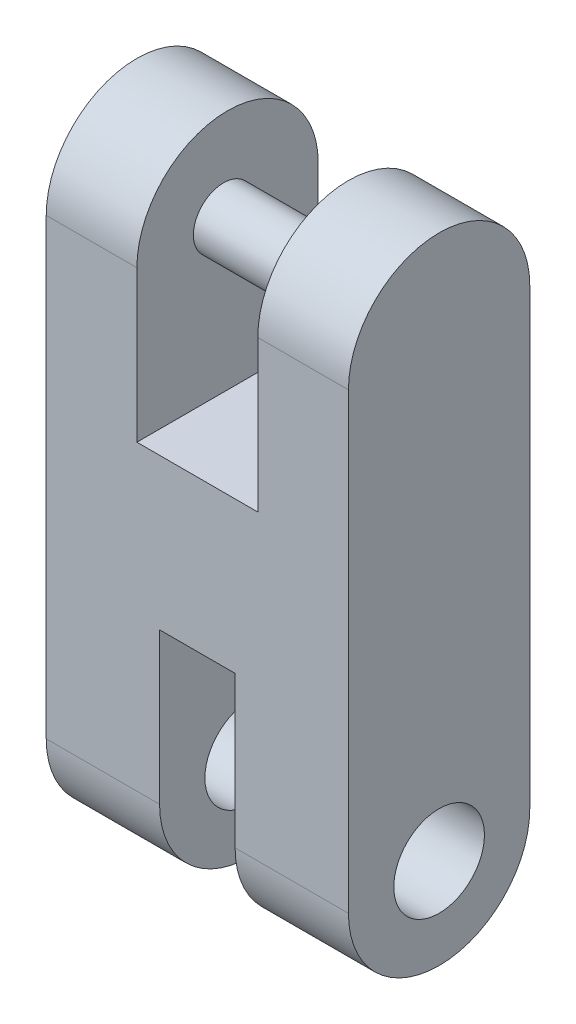
from build123d import *

# Parameters (mm, degrees)
SALIENTE_EXTRUIR1_DEPTH = 6
REDONDEO1_RADIUS        = 3
REDONDEO1_LENGTH        = 3.75
REDONDEO2_RADIUS        = 3
REDONDEO2_LENGTH        = 3
REDONDEO3_RADIUS        = 3
REDONDEO3_LENGTH        = 3
REDONDEO4_RADIUS        = 3
REDONDEO4_LENGTH        = 3.75
CORTAR_EXTRUIR1_REACH   = 26.021
CROQUIS2_R              = 1.5
SALIENTE_EXTRUIR3_REACH = 24.935
CROQUIS4_R              = 1


with BuildPart() as part:
    # Croquis1 → Saliente-Extruir1 (new body)
    with BuildSketch(Plane.XY):
        Polygon((-7, 21), (-7, 13), (-3, 13), (-3, 21), (0, 21), (0, 0), (-3.75, 0), (-3.75, 8), (-6.25, 8), (-6.25, 0), (-10, 0), (-10, 21), align=None)
    extrude(amount=SALIENTE_EXTRUIR1_DEPTH)

    # Redondeo1: full round fillet: the end face becomes a half cylinder, R = half its width
    redondeo1_face = Plane((-1.875, 0, 3), x_dir=(1, 0, 0), z_dir=(0, -1, 0))  # on the end face: x along it, z out of the body
    redondeo1_slab = redondeo1_face.offset(-REDONDEO1_RADIUS / 2) * Box(REDONDEO1_LENGTH, 2 * REDONDEO1_RADIUS, REDONDEO1_RADIUS, mode=Mode.PRIVATE)  # the body's end, R deep
    redondeo1_round = Plane((-1.875, 3, 3), x_dir=(0, -1, 0), z_dir=(1, 0, 0)) * Cylinder(REDONDEO1_RADIUS, REDONDEO1_LENGTH, mode=Mode.PRIVATE)  # its axis R under the face
    add(redondeo1_slab - redondeo1_round, mode=Mode.SUBTRACT)

    # Redondeo2: full round fillet: the end face becomes a half cylinder, R = half its width
    redondeo2_face = Plane((-1.5, 21, 3), x_dir=(-1, 0, 0), z_dir=(0, 1, 0))  # on the end face: x along it, z out of the body
    redondeo2_slab = redondeo2_face.offset(-REDONDEO2_RADIUS / 2) * Box(REDONDEO2_LENGTH, 2 * REDONDEO2_RADIUS, REDONDEO2_RADIUS, mode=Mode.PRIVATE)  # the body's end, R deep
    redondeo2_round = Plane((-1.5, 18, 3), x_dir=(0, 1, 0), z_dir=(-1, 0, 0)) * Cylinder(REDONDEO2_RADIUS, REDONDEO2_LENGTH, mode=Mode.PRIVATE)  # its axis R under the face
    add(redondeo2_slab - redondeo2_round, mode=Mode.SUBTRACT)

    # Redondeo3: full round fillet: the end face becomes a half cylinder, R = half its width
    redondeo3_face = Plane((-8.5, 21, 3), x_dir=(-1, 0, 0), z_dir=(0, 1, 0))  # on the end face: x along it, z out of the body
    redondeo3_slab = redondeo3_face.offset(-REDONDEO3_RADIUS / 2) * Box(REDONDEO3_LENGTH, 2 * REDONDEO3_RADIUS, REDONDEO3_RADIUS, mode=Mode.PRIVATE)  # the body's end, R deep
    redondeo3_round = Plane((-8.5, 18, 3), x_dir=(0, 1, 0), z_dir=(-1, 0, 0)) * Cylinder(REDONDEO3_RADIUS, REDONDEO3_LENGTH, mode=Mode.PRIVATE)  # its axis R under the face
    add(redondeo3_slab - redondeo3_round, mode=Mode.SUBTRACT)

    # Redondeo4: full round fillet: the end face becomes a half cylinder, R = half its width
    redondeo4_face = Plane((-8.125, 0, 3), x_dir=(1, 0, 0), z_dir=(0, -1, 0))  # on the end face: x along it, z out of the body
    redondeo4_slab = redondeo4_face.offset(-REDONDEO4_RADIUS / 2) * Box(REDONDEO4_LENGTH, 2 * REDONDEO4_RADIUS, REDONDEO4_RADIUS, mode=Mode.PRIVATE)  # the body's end, R deep
    redondeo4_round = Plane((-8.125, 3, 3), x_dir=(0, -1, 0), z_dir=(1, 0, 0)) * Cylinder(REDONDEO4_RADIUS, REDONDEO4_LENGTH, mode=Mode.PRIVATE)  # its axis R under the face
    add(redondeo4_slab - redondeo4_round, mode=Mode.SUBTRACT)

    # Cortar-Extruir1: up to this face of the body (flat: up to its plane)
    cortar_extruir1_end = Plane(part.part.faces().sort_by_distance((-10, 10.5, 3))[0])
    # Croquis2 → Cortar-Extruir1 (cut, up to the picked face)
    with BuildSketch(Plane(origin=(0, 0, 0), x_dir=(0, 0, -1), z_dir=(1, 0, 0)), mode=Mode.PRIVATE) as cortar_extruir1_sk1:
        with Locations((-3, 3)):
            Circle(CROQUIS2_R)
    cortar_extruir1_tool1 = split(extrude(cortar_extruir1_sk1.sketch, amount=-CORTAR_EXTRUIR1_REACH, mode=Mode.PRIVATE), bisect_by=cortar_extruir1_end, keep=Keep.BOTH, mode=Mode.PRIVATE)
    add(cortar_extruir1_tool1.solids().sort_by(Axis((0, 3, 3), (-1, 0, 0)))[0], mode=Mode.SUBTRACT)

    # Croquis4 → Saliente-Extruir3 (add, up to next)
    with BuildSketch(Plane(origin=(-7, 0, 0), x_dir=(0, 0, -1), z_dir=(1, 0, 0)), mode=Mode.PRIVATE) as saliente_extruir3_sk1:
        with Locations(Location((-3.130856321, 18, 0), (0, 0, 270))):
            Circle(CROQUIS4_R)
    saliente_extruir3_tool1 = extrude(saliente_extruir3_sk1.sketch, amount=SALIENTE_EXTRUIR3_REACH, mode=Mode.PRIVATE) - part.part
    add(saliente_extruir3_tool1.solids().sort_by_distance((-7, 18, 3.130856))[0])


solid = part.part
